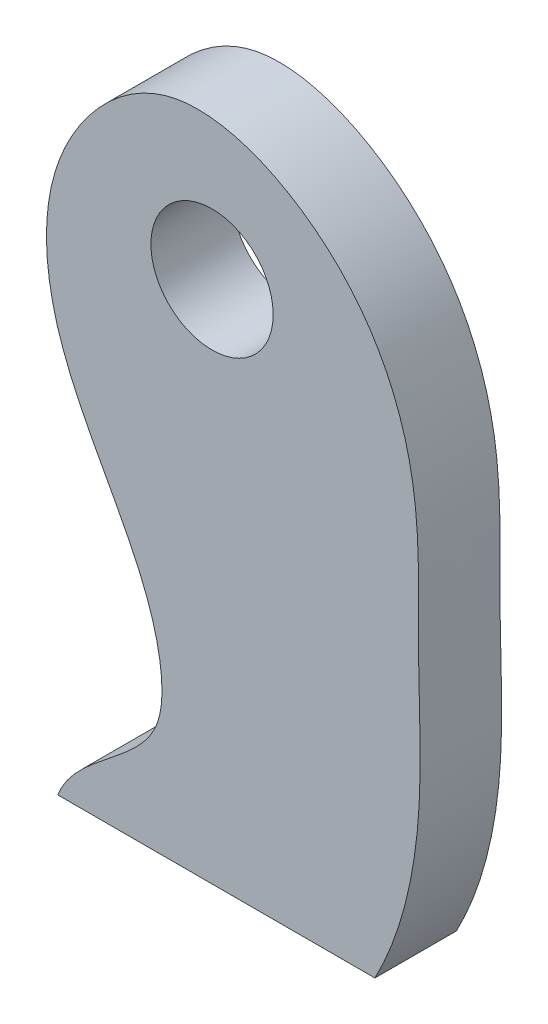
from build123d import *

# Parameters (mm, degrees)
SKETCH1_R           = 2.38125
BOSS_EXTRUDE1_DEPTH = 3.175


with BuildPart() as part:
    # Sketch1 → Boss-Extrude1 (new body)
    with BuildSketch(Plane.XY):
        with BuildLine():
            Line((83.756919199, 33.05458632), (96.106909433, 33.05458632))
            add(Edge.make_bspline(
                [(83.756919199, 33.05458632), (84.428680863, 34.854049116), (87.929407152, 35.947259939), (87.809857743, 40.200883831), (86.224259391, 43.947296041), (83.337150862, 48.373812401), (82.995275031, 54.691016916), (88.014546246, 60.454715647), (95.371466931, 56.929577857), (97.988575047, 50.846693358), (97.701864555, 44.942165301), (98.079336199, 39.049970798), (97.137828324, 35.006663801), (96.106909433, 33.05458632)],
                knots=[0, 0, 0, 0, 0.09468457, 0.131840783, 0.192874931, 0.295783708, 0.386702851, 0.487737795, 0.604574916, 0.709962983, 0.800957829, 0.891876972, 1, 1, 1, 1], degree=3))
        make_face()
        with Locations((89.761960322, 53.449065604)):
            Circle(SKETCH1_R, mode=Mode.SUBTRACT)
    extrude(amount=BOSS_EXTRUDE1_DEPTH)


solid = part.part
